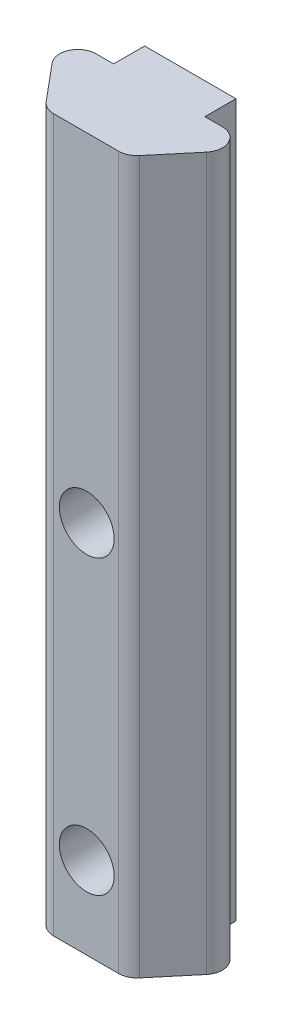
from build123d import *

# Parameters (mm, degrees)
BOSS_EXTRUDE1_DEPTH = 49.53
SKETCH2_R           = 1.905
CUT_EXTRUDE1_DEPTH  = 7.239


with BuildPart() as part:
    # Sketch1 → Boss-Extrude1 (new body)
    with BuildSketch(Plane(origin=(0, 0, 0), x_dir=(1, 0, 0), z_dir=(0, 1, 0))):
        with BuildLine():
            Line((0.592937145, 0), (5.122062855, 0))
            ThreePointArc((5.122062855, 0), (5.659328642, 0.119241348), (6.095705772, 0.454574057))
            Line((6.095705772, 0.454574057), (8.222955772, 2.994574057))
            ThreePointArc((8.222955772, 2.994574057), (8.400071506, 4.347265787), (7.249312855, 5.08))
            Line((7.249312855, 5.08), (6.0325, 5.08))
            Line((6.0325, 5.08), (6.0325, 7.239))
            Line((6.0325, 7.239), (-0.3175, 7.239))
            Line((-0.3175, 7.239), (-0.3175, 5.08))
            Line((-0.3175, 5.08), (-1.534312855, 5.08))
            ThreePointArc((-1.534312855, 5.08), (-2.685071506, 4.347265787), (-2.507955772, 2.994574057))
            Line((-2.507955772, 2.994574057), (-0.380705772, 0.454574057))
            ThreePointArc((-0.380705772, 0.454574057), (0.055671358, 0.119241348), (0.592937145, 0))
        make_face()
    extrude(amount=BOSS_EXTRUDE1_DEPTH)

    # Sketch2 → Cut-Extrude1 (cut)
    with BuildSketch(Plane(origin=(0, 0, -7.239), x_dir=(-1, 0, 0), z_dir=(0, 0, -1))):
        with Locations((-2.897477191, 5.715)):
            Circle(SKETCH2_R)
        with Locations((-2.897477191, 26.035)):
            Circle(SKETCH2_R)
    extrude(amount=-CUT_EXTRUDE1_DEPTH, mode=Mode.SUBTRACT)


solid = part.part
